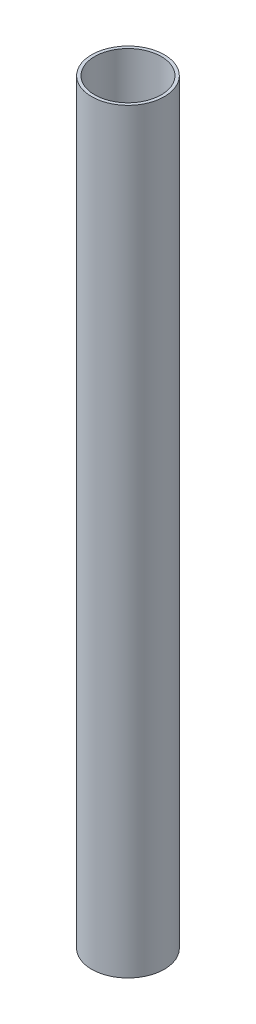
from build123d import *

# Parameters (mm, degrees)
SKETCH1_R           = 84.1375
SKETCH1_R_2         = 77.0255
BOSS_EXTRUDE1_DEPTH = 1750


with BuildPart() as part:
    # Sketch1 → Boss-Extrude1 (new body)
    with BuildSketch(Plane(origin=(0, 0, 0), x_dir=(1, 0, 0), z_dir=(0, 1, 0))):
        with Locations(Location((0, 0, 0), (0, 0, 270))):
            Circle(SKETCH1_R)
        with Locations(Location((0, 0, 0), (0, 0, 270))):
            Circle(SKETCH1_R_2, mode=Mode.SUBTRACT)
    extrude(amount=BOSS_EXTRUDE1_DEPTH)


solid = part.part
